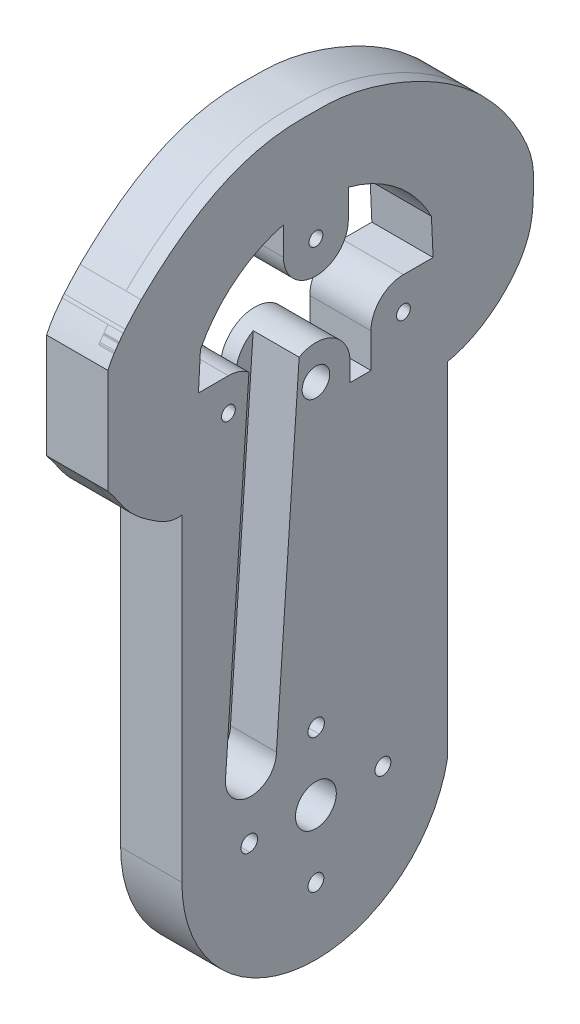
from build123d import *

# Parameters (mm, degrees)
ESQUISSE1_R        = 1.5499999999999952
ESQUISSE1_R_2      = 1.5499999999999983
ESQUISSE1_R_3      = 4.000000000000001
ESQUISSE1_R_4      = 1.5499999999999987
ESQUISSE1_R_5      = 1.3525499999999895
ESQUISSE1_R_6      = 2.705099999999987
ESQUISSE1_R_7      = 1.3525499999999888
ESQUISSE1_R_8      = 1.3525499999999855
BOSS_EXTRU_1_DEPTH = 3
ESQUISSE3_R        = 1.3525499999999735
ESQUISSE3_R_2      = 2.705099999999999
ESQUISSE3_R_3      = 1.352549999999999
ESQUISSE3_R_4      = 1.3525499999999995
ESQUISSE3_R_5      = 1.5499999999999932
ESQUISSE3_R_6      = 1.549999999999969
ESQUISSE3_R_7      = 4.00000000000002
BOSS_EXTRU_2_DEPTH = 6
ESQUISSE4_R        = 1.5499999999999932
ESQUISSE4_R_2      = 4.00000000000002
ESQUISSE4_R_3      = 1.5500000000000196
ESQUISSE4_R_4      = 1.3525499999999724
ESQUISSE4_R_5      = 2.705099999999999
ESQUISSE4_R_6      = 1.352549999999999
BOSS_EXTRU_3_DEPTH = 3


with BuildPart() as part:
    # Esquisse1 → Boss.-Extru.1 (new body)
    with BuildSketch(Plane(origin=(0, 0, 0), x_dir=(0, 0, -1), z_dir=(1, 0, 0))):
        with BuildLine():
            Line((-40.60824999999997, -12.7), (-40.60824999999999, -16.144875000000003))
            Line((-40.60824999999999, -16.144875000000003), (-40.608250000000126, -16.348305131634127))
            add(Edge.make_bspline(
                [(-40.608250000000126, -16.34830513163413), (-40.365634485085174, -16.66119360496381), (-40.112338127058464, -16.96547541984117), (-39.6302050699173, -17.593748723066007), (-39.40068803219234, -17.91719199232713), (-38.71904593852416, -18.893089110716275), (-38.271947043549716, -19.549593056857432), (-37.33854099825812, -20.83100680823567), (-36.855460104120894, -21.45851634129644), (-36.059725811103526, -22.342477590803163), (-35.781944123669106, -22.627029046840978), (-35.20286821244409, -23.177185479911834), (-34.90067438266666, -23.443503751290823), (-33.97194316580395, -24.212706180874235), (-33.32440588222247, -24.68538384924446), (-32.01080528172552, -25.604549776135908), (-31.3480895281368, -26.055770332520353), (-30.303090708448146, -26.660610545558157), (-29.948270215296816, -26.84869689164848), (-29.22248372075406, -27.18497100489982), (-28.851412003903157, -27.33377353761804), (-28.083597976471083, -27.570691367701894), (-27.685315555358933, -27.65797605698594), (-27.090666934399625, -27.715403345514545), (-26.891908645154633, -27.72263102460254), (-26.592836887932044, -27.71293649097741), (-26.492990430934693, -27.70627899212659), (-26.29296393574283, -27.68563201362946), (-26.19273293174235, -27.670522326028014), (-26.092449031487906, -27.65425000000004)],
                knots=[0, 0, 0, 0, 0.06250000000000011, 0.06250000000000011, 0.12500000000000022, 0.12500000000000022, 0.25, 0.25, 0.3749999999999998, 0.3749999999999998, 0.4374999999999999, 0.4374999999999999, 0.5, 0.5, 0.6249999999999997, 0.6249999999999997, 0.7499999999999993, 0.7499999999999993, 0.8124999999999996, 0.8124999999999996, 0.8749999999999998, 0.8749999999999998, 0.9375, 0.9375, 0.96875, 0.96875, 0.9843750000000001, 0.9843750000000001, 1, 1, 1, 1], degree=3))
            Line((-26.09244903148791, -27.654250000000037), (-26.09244903148791, -90))
            ThreePointArc((-26.092449031487916, -90), (2.645516689864672, -116.14013033987462), (25.954024412489332, -85.0613505097137))
            Line((25.954024412489336, -85.0613505097137), (25.954024412489336, -27.654249999999962))
            add(Edge.make_bspline(
                [(25.954024412489336, -27.654249999999955), (27.179118801718648, -27.419536533166706), (28.35337780768259, -27.051803075117984), (30.057053830202985, -26.349187710343546), (30.61512648477753, -26.0892884726289), (31.712904721010446, -25.521429222970447), (32.254485023866394, -25.21211881538357), (33.82720410612195, -24.230350535962074), (34.81402546285917, -23.502087852235476), (36.67200735830084, -21.907218092873883), (37.54332030538343, -21.040793316177776), (38.75190277114726, -19.623473398466476), (39.13471450874684, -19.13496298945798), (39.85101433311271, -18.131439591198927), (40.185535135183365, -17.615291382357196), (40.80136236177384, -16.5505955575091), (41.08263549692741, -16.002027673376396), (41.45701591121505, -15.150237788716874), (41.574249194133394, -14.860422639608764), (41.78971390606594, -14.277065553938337), (41.88804924830858, -13.983513219853538), (42.33468853404608, -12.506770958760937), (42.54623976115454, -11.296312151355938), (42.71756835639342, -9.451511475078737), (42.75061164947975, -8.83067760967362), (42.77285986561765, -7.900507945962923), (42.775360473707075, -7.590422151145716), (42.775559929710695, -6.97022199764531), (42.77208725179593, -6.660100669995436), (42.77208725179598, -6.35000000000085)],
                knots=[0, 0, 0, 0, 0.12499999999999994, 0.12499999999999994, 0.18750000000000008, 0.18750000000000008, 0.2500000000000002, 0.2500000000000002, 0.3750000000000005, 0.3750000000000005, 0.5000000000000008, 0.5000000000000008, 0.5625000000000008, 0.5625000000000008, 0.6250000000000007, 0.6250000000000007, 0.6875000000000007, 0.6875000000000007, 0.7187500000000006, 0.7187500000000006, 0.7500000000000004, 0.7500000000000004, 0.875, 0.875, 0.9374999999999999, 0.9374999999999999, 0.9687499999999999, 0.9687499999999999, 1, 1, 1, 1], degree=3))
            add(Edge.make_bspline(
                [(42.77208725179598, -6.35000000000085), (42.77208725179518, -5.874878454420338), (42.783792206527956, -5.398095979474916), (42.789657916868265, -4.447020545876502), (42.781867466952676, -3.9730044626685204), (42.67254639574517, -2.563152451263197), (42.49917921337603, -1.6375101083020898), (42.10628201696776, -0.2678974591353784), (41.95406853551253, 0.18562504169659108), (41.61481943500583, 1.0877287930782762), (41.430081296584, 1.5302830339265894), (40.84491149528861, 2.8392590835466924), (40.41660456120057, 3.689518780701334), (39.04678328265365, 6.190525131350697), (38.01312330399673, 7.7872515841477075), (36.29165744568243, 10.08210697671183), (35.68850954706187, 10.830664164257108), (34.43654182017242, 12.281738952771459), (33.78619988302627, 12.985690235020341), (33.11207499999998, 13.668565083231329)],
                knots=[0, 0, 0, 0, 0.06250000000000003, 0.06250000000000003, 0.12500000000000006, 0.12500000000000006, 0.24999999999999997, 0.24999999999999997, 0.3124999999999999, 0.3124999999999999, 0.3749999999999999, 0.3749999999999999, 0.5000000000000002, 0.5000000000000002, 0.7500000000000003, 0.7500000000000003, 0.8750000000000001, 0.8750000000000001, 1, 1, 1, 1], degree=3))
            add(Edge.make_bspline(
                [(33.112075, 13.668565083231325), (32.33220795486775, 14.539101946139125), (31.435060987062897, 15.277734234492385)],
                knots=[0, 0, 0, 1, 1, 1], degree=2))
            add(Edge.make_bspline(
                [(31.435060987062897, 15.277734234492385), (30.299691041308236, 16.309376592490306), (29.113704515664836, 17.275445234871217), (26.6466048305771, 19.084346085125258), (25.360475951228903, 19.928267183493574), (21.43229776932603, 22.265681685749215), (18.701678279528252, 23.563722979210173), (14.477833081648752, 25.213127628280468), (13.049229105244862, 25.71486415952927), (10.864398428424204, 26.369911185203367), (10.12906170309748, 26.57183213638624), (8.641563989669635, 26.936524394267035), (7.89083157192484, 27.098844789097125), (5.637990781516612, 27.51241220781118), (4.127431428249407, 27.69372769630636), (2.225306731202307, 27.768676851477696), (1.844136037536198, 27.775542931063026), (1.0809407860587825, 27.779973661479737), (0.6989047691417656, 27.77741348442609), (-0.44634668852812603, 27.779064109234426), (-1.208874123410741, 27.797823926116227), (-2.7326822388819156, 27.815308111039577), (-3.4920854713532217, 27.806304752702626), (-5.004084105432311, 27.739990771478098), (-5.756994671196242, 27.684916502368054), (-8.006157922423963, 27.451797552402233), (-9.492662783689791, 27.204583890743887), (-11.701987235660551, 26.68877527741111), (-12.434852330937622, 26.49146159823533), (-13.894254142024575, 26.051929084747414), (-14.622118918624757, 25.80749349719222), (-16.765417144448694, 25.012233880270134), (-18.15150036933967, 24.400517873976742), (-20.847821734692953, 23.032525232038434), (-22.158708475332947, 22.277484827463585), (-24.716496251974732, 20.645447350961245), (-25.966430559050142, 19.765232599712107), (-28.39125747007988, 17.919703458017853), (-29.567431908494203, 16.954258356946394), (-31.28755717277032, 15.454109034176787), (-31.853805839893464, 14.945666112150485), (-32.972832422867484, 13.912915080440603), (-33.52577930998253, 13.388805976793128), (-34.06609644329648, 12.849822170905842)],
                knots=[0, 0, 0, 0, 0.06250000000000003, 0.06250000000000003, 0.12500000000000006, 0.12500000000000006, 0.25000000000000033, 0.25000000000000033, 0.3125000000000005, 0.3125000000000005, 0.34375000000000056, 0.34375000000000056, 0.3750000000000006, 0.3750000000000006, 0.4375000000000006, 0.4375000000000006, 0.4531250000000006, 0.4531250000000006, 0.4687500000000006, 0.4687500000000006, 0.5000000000000006, 0.5000000000000006, 0.5312500000000006, 0.5312500000000006, 0.5625000000000006, 0.5625000000000006, 0.6250000000000006, 0.6250000000000006, 0.6562500000000006, 0.6562500000000006, 0.6875000000000006, 0.6875000000000006, 0.7500000000000004, 0.7500000000000004, 0.8125000000000003, 0.8125000000000003, 0.8750000000000002, 0.8750000000000002, 0.9375000000000002, 0.9375000000000002, 0.9687500000000001, 0.9687500000000001, 1, 1, 1, 1], degree=3))
            add(Edge.make_bspline(
                [(-34.06609644329648, 12.849822170905837), (-35.159801617542875, 11.692162737351145), (-36.25108162130856, 10.537402840079448), (-37.16658053159576, 9.40494717090583)],
                knots=[0, 0, 0, 0, 1, 1, 1, 1], degree=3))
            ThreePointArc((-37.16658053159577, 9.404947170905835), (-37.36301468524006, 9.16028104187254), (-37.55779661569344, 8.914297524166702))
            add(Edge.make_bspline(
                [(-37.55779661569345, 8.914297524166699), (-38.142933538997205, 8.170182683428195), (-38.70952284495091, 7.412667282430255), (-39.741912271517116, 5.824816800894257), (-40.203133529042645, 4.998794666098791), (-40.60824999999987, 4.142494902026808)],
                knots=[0, 0, 0, 0, 0.5, 0.5, 1, 1, 1, 1], degree=3))
            Line((-40.60824999999987, 4.142494902026814), (-40.60824999999997, -12.7))
        make_face()
        with Locations((0.16510000000002353, -103.12877451574396)):
            Circle(ESQUISSE1_R, mode=Mode.SUBTRACT)
        with Locations((-12.963674515743943, -90.0000000000001)):
            Circle(ESQUISSE1_R_2, mode=Mode.SUBTRACT)
        with Locations((0.16510000000001498, -90)):
            Circle(ESQUISSE1_R_3, mode=Mode.SUBTRACT)
        with Locations((0.1650999999999718, -76.87122548425604)):
            Circle(ESQUISSE1_R_4, mode=Mode.SUBTRACT)
        with Locations((13.293874515743973, -90)):
            Circle(ESQUISSE1_R_2, mode=Mode.SUBTRACT)
        with Locations((-16.979899999999997, -14.922499999999971)):
            Circle(ESQUISSE1_R_5, mode=Mode.SUBTRACT)
        with Locations((0.16510000000000483, -18.224499999999964)):
            Circle(ESQUISSE1_R_6, mode=Mode.SUBTRACT)
        with BuildLine():
            Line((-6.184899999999998, 11.646916554029167), (-6.184899999999998, 6.103472305612069))
            ThreePointArc((-6.184899999999998, 6.103472305612069), (0.165100000000006, -0.24652769438792888), (6.51510000000001, 6.103472305612069))
            Line((6.51510000000001, 6.103472305612069), (6.51510000000001, 11.646916554029167))
            ThreePointArc((6.5151000000000145, 11.646916554029168), (16.056799278049922, 6.8679592799454525), (22.793325, -1.4086148263959402))
            Line((22.793324999999996, -1.408614826395942), (23.125904239958533, -8.57249999999997))
            Line((23.125904239958533, -8.57249999999997), (17.310100000000006, -8.572499999999971))
            ThreePointArc((17.310100000000006, -8.572499999999973), (12.819971939465429, -10.432371939465394), (10.960100000000008, -14.922499999999971))
            Line((10.960100000000006, -14.922499999999971), (10.960100000000006, -21.66937500000002))
            Line((10.960100000000006, -21.66937500000002), (6.880225000000006, -21.669375000000013))
            Line((6.880225000000006, -21.669375000000013), (6.880225000000006, -18.224499999999964))
            ThreePointArc((6.880225000000005, -18.224499999999964), (0.16510000000000466, -11.509374999999963), (-6.550024999999996, -18.224499999999964))
            Line((-6.550024999999996, -18.224499999999964), (-6.550024999999996, -21.669374999999995))
            Line((-6.550024999999996, -21.669374999999995), (-10.629899999999996, -21.669374999999988))
            Line((-10.629899999999996, -21.669374999999988), (-10.629899999999996, -14.922499999999971))
            ThreePointArc((-10.629899999999996, -14.922499999999971), (-12.48977193946542, -10.432371939465394), (-16.979899999999997, -8.57249999999997))
            Line((-16.979899999999997, -8.572499999999971), (-22.848998606298945, -8.57249999999997))
            Line((-22.848998606298945, -8.57249999999997), (-22.463124999999994, -1.408614826395956))
            ThreePointArc((-22.463124999999994, -1.4086148263959526), (-15.726599278049921, 6.867959279945454), (-6.184899999999998, 11.646916554029167))
        make_face(mode=Mode.SUBTRACT)
        with Locations((0.16510000000000144, 6.103472305612071)):
            Circle(ESQUISSE1_R_7, mode=Mode.SUBTRACT)
        with Locations((17.310100000000006, -14.922499999999971)):
            Circle(ESQUISSE1_R_8, mode=Mode.SUBTRACT)
    extrude(amount=BOSS_EXTRU_1_DEPTH)

    # Esquisse3 → Boss.-Extru.2 (add)
    with BuildSketch(Plane(origin=(3, 0, 0), x_dir=(0, 0, -1), z_dir=(1, 0, 0))):
        with BuildLine():
            Line((-40.608249999999984, -16.144875000000003), (-40.608250000000126, -16.348305131634127))
            add(Edge.make_bspline(
                [(-40.608250000000126, -16.348305131634127), (-40.36563448508518, -16.66119360496381), (-40.11233812705847, -16.96547541984117), (-39.630205069917295, -17.593748723066007), (-39.40068803219235, -17.91719199232713), (-38.719045938524154, -18.893089110716275), (-38.27194704354972, -19.549593056857436), (-37.33854099825812, -20.831006808235674), (-36.85546010412089, -21.45851634129644), (-36.05972581110353, -22.342477590803167), (-35.78194412366911, -22.627029046840978), (-35.20286821244409, -23.177185479911838), (-34.90067438266666, -23.443503751290823), (-33.97194316580396, -24.212706180874235), (-33.324405882222464, -24.68538384924446), (-32.01080528172551, -25.6045497761359), (-31.348089528136807, -26.055770332520353), (-30.30309070844814, -26.66061054555816), (-29.94827021529681, -26.848696891648473), (-29.22248372075406, -27.18497100489983), (-28.85141200390315, -27.33377353761805), (-28.083597976471086, -27.5706913677019), (-27.68531555535894, -27.65797605698594), (-27.090666934399625, -27.715403345514545), (-26.891908645154643, -27.72263102460255), (-26.59283688793204, -27.712936490977416), (-26.4929904309347, -27.7062789921266), (-26.292963935742847, -27.68563201362946), (-26.192732931742345, -27.670522326028024), (-26.092449031487913, -27.654250000000044)],
                knots=[0, 0, 0, 0, 0.06250000000000011, 0.06250000000000011, 0.12500000000000022, 0.12500000000000022, 0.25, 0.25, 0.3749999999999998, 0.3749999999999998, 0.4374999999999999, 0.4374999999999999, 0.5, 0.5, 0.6249999999999997, 0.6249999999999997, 0.7499999999999993, 0.7499999999999993, 0.8124999999999996, 0.8124999999999996, 0.8749999999999998, 0.8749999999999998, 0.9375, 0.9375, 0.96875, 0.96875, 0.9843750000000001, 0.9843750000000001, 1, 1, 1, 1], degree=3))
            Line((-26.092449031487913, -27.654250000000044), (-26.092449031487913, -89.99999999999983))
            ThreePointArc((-26.092449031487913, -89.99999999999983), (-2.3153166898646287, -116.14013033987443), (25.95402441248934, -94.93864949028602))
            Line((25.95402441248934, -94.93864949028602), (25.95402441248934, -27.654249999999973))
            add(Edge.make_bspline(
                [(25.95402441248934, -27.654249999999973), (27.179118801718637, -27.41953653316671), (28.3533778076826, -27.05180307511799), (30.05705383020299, -26.349187710343546), (30.615126484777544, -26.0892884726289), (31.71290472101046, -25.52142922297045), (32.25448502386641, -25.212118815383562), (33.82720410612195, -24.230350535962074), (34.81402546285916, -23.502087852235476), (36.67200735830084, -21.907218092873883), (37.54332030538343, -21.040793316177776), (38.751902771147265, -19.62347339846648), (39.13471450874684, -19.134962989457982), (39.85101433311272, -18.131439591198927), (40.18553513518336, -17.615291382357196), (40.80136236177384, -16.5505955575091), (41.08263549692742, -16.002027673376396), (41.45701591121506, -15.150237788716874), (41.57424919413339, -14.860422639608764), (41.78971390606595, -14.277065553938337), (41.888049248308576, -13.983513219853538), (42.334688534046094, -12.506770958760939), (42.54623976115454, -11.296312151355938), (42.71756835639343, -9.451511475078735), (42.750611649479744, -8.83067760967362), (42.772859865617654, -7.900507945962923), (42.77536047370706, -7.590422151145717), (42.77555992971069, -6.970221997645309), (42.77208725179593, -6.660100669995436), (42.77208725179599, -6.35000000000085)],
                knots=[0, 0, 0, 0, 0.12499999999999994, 0.12499999999999994, 0.18750000000000008, 0.18750000000000008, 0.2500000000000002, 0.2500000000000002, 0.3750000000000005, 0.3750000000000005, 0.5000000000000008, 0.5000000000000008, 0.5625000000000008, 0.5625000000000008, 0.6250000000000007, 0.6250000000000007, 0.6875000000000007, 0.6875000000000007, 0.7187500000000006, 0.7187500000000006, 0.7500000000000004, 0.7500000000000004, 0.875, 0.875, 0.9374999999999999, 0.9374999999999999, 0.9687499999999999, 0.9687499999999999, 1, 1, 1, 1], degree=3))
            add(Edge.make_bspline(
                [(42.77208725179599, -6.35000000000085), (42.772087251795185, -5.8748784544203385), (42.78379220652795, -5.398095979474917), (42.78965791686826, -4.447020545876503), (42.781867466952676, -3.9730044626685204), (42.672546395745165, -2.5631524512631976), (42.49917921337604, -1.6375101083020895), (42.106282016967754, -0.2678974591353786), (41.95406853551253, 0.18562504169659066), (41.614819435005835, 1.0877287930782762), (41.430081296583985, 1.5302830339265894), (40.84491149528863, 2.8392590835466924), (40.41660456120058, 3.6895187807013343), (39.04678328265365, 6.190525131350697), (38.01312330399673, 7.7872515841477075), (36.29165744568244, 10.082106976711827), (35.68850954706188, 10.830664164257106), (34.436541820172415, 12.28173895277146), (33.78619988302628, 12.98569023502034), (33.11207499999999, 13.668565083231329)],
                knots=[0, 0, 0, 0, 0.06250000000000003, 0.06250000000000003, 0.12500000000000006, 0.12500000000000006, 0.24999999999999997, 0.24999999999999997, 0.3124999999999999, 0.3124999999999999, 0.3749999999999999, 0.3749999999999999, 0.5000000000000002, 0.5000000000000002, 0.7500000000000003, 0.7500000000000003, 0.8750000000000001, 0.8750000000000001, 1, 1, 1, 1], degree=3))
            add(Edge.make_bspline(
                [(33.11207499999999, 13.668565083231329), (32.33220795486774, 14.539101946139121), (31.43506098706289, 15.277734234492382)],
                knots=[0, 0, 0, 1, 1, 1], degree=2))
            add(Edge.make_bspline(
                [(31.43506098706289, 15.277734234492382), (30.299691041308225, 16.309376592490302), (29.113704515664836, 17.275445234871217), (26.646604830577097, 19.084346085125258), (25.360475951228896, 19.92826718349357), (21.432297769326038, 22.265681685749215), (18.70167827952826, 23.56372297921017), (14.47783308164874, 25.213127628280468), (13.049229105244864, 25.714864159529267), (10.86439842842421, 26.369911185203367), (10.129061703097491, 26.57183213638624), (8.641563989669642, 26.936524394267035), (7.890831571924828, 27.09884478909713), (5.637990781516611, 27.51241220781118), (4.127431428249395, 27.693727696306357), (2.2253067312023034, 27.768676851477696), (1.8441360375361926, 27.77554293106303), (1.080940786058776, 27.77997366147974), (0.6989047691417782, 27.777413484426095), (-0.4463466885281375, 27.77906410923443), (-1.2088741234107525, 27.797823926116234), (-2.732682238881928, 27.815308111039574), (-3.4920854713532123, 27.806304752702623), (-5.004084105432321, 27.739990771478105), (-5.756994671196253, 27.68491650236805), (-8.006157922423956, 27.451797552402233), (-9.492662783689793, 27.204583890743884), (-11.701987235660544, 26.68877527741111), (-12.434852330937607, 26.491461598235333), (-13.89425414202458, 26.051929084747414), (-14.62211891862475, 25.807493497192215), (-16.76541714444868, 25.012233880270134), (-18.151500369339658, 24.40051787397674), (-20.84782173469296, 23.03252523203843), (-22.15870847533294, 22.27748482746358), (-24.716496251974725, 20.64544735096124), (-25.966430559050153, 19.765232599712103), (-28.391257470079896, 17.919703458017853), (-29.5674319084942, 16.954258356946394), (-31.28755717277032, 15.454109034176783), (-31.85380583989347, 14.945666112150484), (-32.972832422867484, 13.9129150804406), (-33.52577930998253, 13.388805976793126), (-34.06609644329647, 12.849822170905837)],
                knots=[0, 0, 0, 0, 0.06250000000000003, 0.06250000000000003, 0.12500000000000006, 0.12500000000000006, 0.25000000000000033, 0.25000000000000033, 0.3125000000000005, 0.3125000000000005, 0.34375000000000056, 0.34375000000000056, 0.3750000000000006, 0.3750000000000006, 0.4375000000000006, 0.4375000000000006, 0.4531250000000006, 0.4531250000000006, 0.4687500000000006, 0.4687500000000006, 0.5000000000000006, 0.5000000000000006, 0.5312500000000006, 0.5312500000000006, 0.5625000000000006, 0.5625000000000006, 0.6250000000000006, 0.6250000000000006, 0.6562500000000006, 0.6562500000000006, 0.6875000000000006, 0.6875000000000006, 0.7500000000000004, 0.7500000000000004, 0.8125000000000003, 0.8125000000000003, 0.8750000000000002, 0.8750000000000002, 0.9375000000000002, 0.9375000000000002, 0.9687500000000001, 0.9687500000000001, 1, 1, 1, 1], degree=3))
            add(Edge.make_bspline(
                [(-34.06609644329647, 12.849822170905837), (-35.15980161754287, 11.692162737351138), (-36.25108162130857, 10.53740284007944), (-37.16658053159577, 9.404947170905832)],
                knots=[0, 0, 0, 0, 1, 1, 1, 1], degree=3))
            ThreePointArc((-37.16658053159577, 9.404947170905832), (-37.36301468524006, 9.160281041872544), (-37.557796615693434, 8.914297524166692))
            add(Edge.make_bspline(
                [(-37.557796615693434, 8.914297524166692), (-38.14293353899721, 8.170182683428193), (-38.709522844950925, 7.412667282430254), (-39.741912271517116, 5.824816800894257), (-40.20313352904266, 4.998794666098793), (-40.60824999999987, 4.142494902026814)],
                knots=[0, 0, 0, 0, 0.5, 0.5, 1, 1, 1, 1], degree=3))
            Line((-40.60824999999987, 4.142494902026814), (-40.60824999999997, -12.7))
            Line((-40.60824999999997, -12.7), (-40.608249999999984, -16.144875000000003))
        make_face()
        with Locations((-16.979899999999994, -14.922499999999971)):
            Circle(ESQUISSE3_R, mode=Mode.SUBTRACT)
        with Locations((0.16510000000000136, -18.224499999999964)):
            Circle(ESQUISSE3_R_2, mode=Mode.SUBTRACT)
        with Locations((17.310099999999995, -14.922499999999971)):
            Circle(ESQUISSE3_R_3, mode=Mode.SUBTRACT)
        with Locations((0.16510000000000136, 6.103472305612071)):
            Circle(ESQUISSE3_R_4, mode=Mode.SUBTRACT)
        with Locations((0.1651000000000291, -103.12877451574379)):
            Circle(ESQUISSE3_R_5, mode=Mode.SUBTRACT)
        with Locations(Location((-12.818304565236966, -89.99046578621355, 0), (0, 0, 96.445985004))):
            Circle(ESQUISSE3_R_5, mode=Mode.SUBTRACT)
        with Locations(Location((0.27487463552389635, -76.82619220248466, 0), (0, 0, 114.498639067))):
            Circle(ESQUISSE3_R_6, mode=Mode.SUBTRACT)
        with Locations((13.293874515743987, -89.99999999999983)):
            Circle(ESQUISSE3_R_5, mode=Mode.SUBTRACT)
        with Locations((0.16510000000000136, -89.99999999999983)):
            Circle(ESQUISSE3_R_7, mode=Mode.SUBTRACT)
        with BuildLine():
            Line((-6.184899999999994, 6.103472305612069), (-6.184899999999994, 11.646916554029172))
            ThreePointArc((-6.184899999999994, 11.646916554029172), (-15.726599278049925, 6.86795927994546), (-22.463125, -1.408614826395956))
            Line((-22.463125, -1.408614826395956), (-22.848998606298938, -8.57249999999997))
            Line((-22.848998606298938, -8.57249999999997), (-16.979899999999994, -8.57249999999997))
            ThreePointArc((-16.979899999999994, -8.57249999999997), (-14.843492836703497, -8.942678561811752), (-12.956172958809672, -10.010054509412438))
            Line((-12.956172958809672, -10.010054509412438), (-17.524395623099757, -76.45837810021335))
            ThreePointArc((-17.524395623099757, -76.45837810021335), (-12.914369904026863, -82.13085492882756), (-7.5714368538587555, -77.14262909962736))
            Line((-7.5714368538587555, -77.14262909962736), (-3.1181943124567826, -12.366780117365243))
            ThreePointArc((-3.1181943124567826, -12.366780117365243), (3.5595934854620666, -12.430510205153858), (6.880225000000017, -18.224499999999964))
            Line((6.880225000000017, -18.224499999999964), (6.880225000000017, -21.669375000000016))
            Line((6.880225000000017, -21.669375000000016), (10.9601, -21.669375000000024))
            Line((10.9601, -21.669375000000024), (10.9601, -14.922499999999971))
            ThreePointArc((10.9601, -14.922499999999971), (12.819971939465418, -10.432371939465394), (17.310099999999995, -8.57249999999997))
            Line((17.310099999999995, -8.57249999999997), (23.12590423995853, -8.57249999999997))
            Line((23.12590423995853, -8.57249999999997), (22.793325000000003, -1.408614826395942))
            ThreePointArc((22.793325000000003, -1.408614826395942), (16.056799278049926, 6.867959279945467), (6.515099999999996, 11.646916554029172))
            Line((6.515099999999996, 11.646916554029172), (6.515099999999996, 6.103472305612069))
            ThreePointArc((6.515099999999996, 6.103472305612069), (0.16510000000000033, -0.24652769438792443), (-6.184899999999994, 6.103472305612069))
        make_face(mode=Mode.SUBTRACT)
    extrude(amount=BOSS_EXTRU_2_DEPTH)

    # Esquisse4 → Boss.-Extru.3 (add)
    with BuildSketch(Plane(origin=(9.000000000000002, 0, 0), x_dir=(0, 0, -1), z_dir=(1, 0, 0))):
        with BuildLine():
            Line((-40.608249999999956, -12.699999999999832), (-40.608249999999984, -16.144874999999836))
            Line((-40.608249999999984, -16.144874999999836), (-40.608250000000126, -16.34830513163396))
            add(Edge.make_bspline(
                [(-40.608250000000126, -16.348305131633964), (-40.36563448508518, -16.661193604963643), (-40.11233812705847, -16.965475419841002), (-39.630205069917295, -17.59374872306584), (-39.40068803219235, -17.917191992326963), (-38.719045938524154, -18.893089110716108), (-38.27194704354972, -19.549593056857265), (-37.33854099825812, -20.831006808235504), (-36.85546010412089, -21.458516341296278), (-36.05972581110353, -22.342477590802996), (-35.78194412366911, -22.62702904684081), (-35.20286821244409, -23.177185479911667), (-34.900674382666644, -23.44350375129066), (-33.97194316580396, -24.212706180874065), (-33.324405882222464, -24.685383849244293), (-32.01080528172551, -25.604549776135745), (-31.348089528136807, -26.055770332520183), (-30.30309070844814, -26.66061054555799), (-29.94827021529681, -26.848696891648316), (-29.22248372075406, -27.18497100489965), (-28.85141200390315, -27.333773537617873), (-28.083597976471086, -27.570691367701723), (-27.68531555535894, -27.657976056985778), (-27.090666934399625, -27.715403345514382), (-26.891908645154643, -27.72263102460237), (-26.59283688793204, -27.71293649097724), (-26.4929904309347, -27.706278992126425), (-26.29296393574282, -27.685632013629295), (-26.192732931742345, -27.670522326027847), (-26.092449031487913, -27.654249999999873)],
                knots=[0, 0, 0, 0, 0.06250000000000011, 0.06250000000000011, 0.12500000000000022, 0.12500000000000022, 0.25, 0.25, 0.3749999999999998, 0.3749999999999998, 0.4374999999999999, 0.4374999999999999, 0.5, 0.5, 0.6249999999999997, 0.6249999999999997, 0.7499999999999993, 0.7499999999999993, 0.8124999999999996, 0.8124999999999996, 0.8749999999999998, 0.8749999999999998, 0.9375, 0.9375, 0.96875, 0.96875, 0.9843750000000001, 0.9843750000000001, 1, 1, 1, 1], degree=3))
            Line((-26.092449031487913, -27.654249999999866), (-26.092449031487913, -89.99999999999983))
            ThreePointArc((-26.092449031487916, -89.99999999999983), (-2.315316689864583, -116.14013033987443), (25.954024412489385, -94.93864949028604))
            Line((25.95402441248934, -94.93864949028602), (25.95402441248934, -89.99999999999983))
            Line((25.954024412489396, -89.99999999999983), (25.954024412489396, -85.06135050971355))
            Line((25.954024412489396, -85.06135050971355), (25.954024412489396, -27.6542499999998))
            add(Edge.make_bspline(
                [(25.954024412489396, -27.65424999999979), (27.179118801718776, -27.41953653316654), (28.353377807682683, -27.051803075117814), (30.057053830203103, -26.349187710343376), (30.615126484777626, -26.08928847262873), (31.712904721010542, -25.52142922297028), (32.25448502386655, -25.212118815383405), (33.82720410612208, -24.23035053596191), (34.814025462859306, -23.502087852235316), (36.672007358300924, -21.90721809287372), (37.543320305383574, -21.04079331617761), (38.7519027711474, -19.62347339846631), (39.134714508746974, -19.13496298945781), (39.85101433311281, -18.13143959119876), (40.18553513518344, -17.61529138235703), (40.801362361773926, -16.550595557508935), (41.08263549692751, -16.00202767337623), (41.457015911215116, -15.150237788716707), (41.574249194133465, -14.860422639608597), (41.789713906066034, -14.277065553938172), (41.88804924830872, -13.983513219853371), (42.334688534046236, -12.506770958760773), (42.546239761154595, -11.296312151355771), (42.717568356393535, -9.45151147507857), (42.75061164947982, -8.830677609673453), (42.77285986561777, -7.900507945962757), (42.77536047370714, -7.5904221511455505), (42.77555992971085, -6.970221997645142), (42.77208725179607, -6.66010066999527), (42.77208725179607, -6.350000000000682)],
                knots=[0, 0, 0, 0, 0.12499999999999994, 0.12499999999999994, 0.18750000000000008, 0.18750000000000008, 0.2500000000000002, 0.2500000000000002, 0.3750000000000005, 0.3750000000000005, 0.5000000000000008, 0.5000000000000008, 0.5625000000000008, 0.5625000000000008, 0.6250000000000007, 0.6250000000000007, 0.6875000000000007, 0.6875000000000007, 0.7187500000000006, 0.7187500000000006, 0.7500000000000004, 0.7500000000000004, 0.875, 0.875, 0.9374999999999999, 0.9374999999999999, 0.9687499999999999, 0.9687499999999999, 1, 1, 1, 1], degree=3))
            add(Edge.make_bspline(
                [(42.77208725179607, -6.350000000000706), (42.77208725179529, -5.874878454420196), (42.78379220652809, -5.398095979474774), (42.78965791686842, -4.447020545876361), (42.78186746695281, -3.973004462668385), (42.672546395745385, -2.563152451263061), (42.49917921337623, -1.6375101083019525), (42.106282016967896, -0.2678974591352398), (41.954068535512675, 0.18562504169673116), (41.61481943500603, 1.0877287930784185), (41.43008129658413, 1.5302830339267368), (40.84491149528882, 2.83925908354684), (40.41660456120069, 3.689518780701478), (39.04678328265379, 6.190525131350842), (38.01312330399689, 7.787251584147857), (36.29165744568255, 10.082106976711982), (35.68850954706207, 10.830664164257264), (34.43654182017256, 12.281738952771619), (33.78619988302648, 12.985690235020497), (33.11207500000016, 13.668565083231492)],
                knots=[0, 0, 0, 0, 0.06250000000000003, 0.06250000000000003, 0.12500000000000006, 0.12500000000000006, 0.24999999999999997, 0.24999999999999997, 0.3124999999999999, 0.3124999999999999, 0.3749999999999999, 0.3749999999999999, 0.5000000000000002, 0.5000000000000002, 0.7500000000000003, 0.7500000000000003, 0.8750000000000001, 0.8750000000000001, 1, 1, 1, 1], degree=3))
            add(Edge.make_bspline(
                [(33.11207500000016, 13.668565083231492), (32.332207954867826, 14.53910194613929), (31.435060987062975, 15.277734234492552)],
                knots=[0, 0, 0, 1, 1, 1], degree=2))
            add(Edge.make_bspline(
                [(31.435060987062975, 15.277734234492552), (30.299691041308392, 16.309376592490473), (29.11370451566489, 17.27544523487138), (26.646604830577264, 19.08434608512543), (25.360475951229034, 19.92826718349374), (21.43229776932609, 22.265681685749378), (18.7016782795284, 23.56372297921034), (14.477833081648711, 25.21312762828063), (13.049229105244864, 25.714864159529434), (10.86439842842421, 26.369911185203534), (10.129061703097491, 26.571832136386412), (8.641563989669642, 26.9365243942672), (7.890831571924828, 27.098844789097292), (5.637990781516611, 27.512412207811344), (4.127431428249395, 27.693727696306535), (2.2253067312023034, 27.76867685147786), (1.8441360375361926, 27.775542931063192), (1.080940786058776, 27.779973661479904), (0.6989047691417782, 27.77741348442626), (-0.4463466885281375, 27.779064109234593), (-1.2088741234107525, 27.797823926116397), (-2.732682238881928, 27.815308111039737), (-3.4920854713532123, 27.806304752702786), (-5.004084105432321, 27.73999077147827), (-5.756994671196253, 27.684916502368228), (-8.006157922423956, 27.451797552402393), (-9.492662783689793, 27.204583890744058), (-11.701987235660544, 26.688775277411278), (-12.434852330937607, 26.491461598235496), (-13.89425414202458, 26.051929084747577), (-14.62211891862475, 25.807493497192386), (-16.76541714444868, 25.0122338802703), (-18.151500369339658, 24.40051787397691), (-20.84782173469296, 23.0325252320386), (-22.15870847533294, 22.277484827463752), (-24.716496251974725, 20.645447350961412), (-25.966430559050153, 19.765232599712274), (-28.391257470079868, 17.919703458018013), (-29.5674319084942, 16.954258356946564), (-31.28755717277032, 15.454109034176954), (-31.85380583989347, 14.945666112150652), (-32.97283242286747, 13.91291508044077), (-33.52577930998252, 13.388805976793297), (-34.06609644329647, 12.849822170906009)],
                knots=[0, 0, 0, 0, 0.06250000000000003, 0.06250000000000003, 0.12500000000000006, 0.12500000000000006, 0.25000000000000033, 0.25000000000000033, 0.3125000000000005, 0.3125000000000005, 0.34375000000000056, 0.34375000000000056, 0.3750000000000006, 0.3750000000000006, 0.4375000000000006, 0.4375000000000006, 0.4531250000000006, 0.4531250000000006, 0.4687500000000006, 0.4687500000000006, 0.5000000000000006, 0.5000000000000006, 0.5312500000000006, 0.5312500000000006, 0.5625000000000006, 0.5625000000000006, 0.6250000000000006, 0.6250000000000006, 0.6562500000000006, 0.6562500000000006, 0.6875000000000006, 0.6875000000000006, 0.7500000000000004, 0.7500000000000004, 0.8125000000000003, 0.8125000000000003, 0.8750000000000002, 0.8750000000000002, 0.9375000000000002, 0.9375000000000002, 0.9687500000000001, 0.9687500000000001, 1, 1, 1, 1], degree=3))
            add(Edge.make_bspline(
                [(-34.06609644329647, 12.849822170906002), (-35.15980161754287, 11.692162737351307), (-36.25108162130857, 10.537402840079608), (-37.16658053159577, 9.404947170906)],
                knots=[0, 0, 0, 0, 1, 1, 1, 1], degree=3))
            ThreePointArc((-37.16658053159577, 9.404947170906002), (-37.36301468524006, 9.160281041872707), (-37.55779661569342, 8.914297524166852))
            add(Edge.make_bspline(
                [(-37.55779661569345, 8.914297524166878), (-38.14293353899723, 8.170182683428367), (-38.70952284495091, 7.412667282430431), (-39.7419122715171, 5.824816800894431), (-40.203133529042645, 4.998794666098968), (-40.60824999999987, 4.142494902026978)],
                knots=[0, 0, 0, 0, 0.5, 0.5, 1, 1, 1, 1], degree=3))
            Line((-40.60824999999987, 4.142494902026985), (-40.608249999999956, -12.699999999999832))
        make_face()
        with Locations((0.1651000000000291, -103.12877451574379)):
            Circle(ESQUISSE4_R, mode=Mode.SUBTRACT)
        with BuildLine():
            ThreePointArc((-12.789661465336735, -91.54020110968916), (-14.510351565382116, -90.10144015044584), (-12.99231761564418, -88.45026467652431))
            ThreePointArc((-12.99231761564418, -88.45026467652431), (-11.785643010837656, -88.83456349187134), (-11.268304565236972, -89.99046578621355))
            ThreePointArc((-11.268304565236972, -89.99046578621355), (-11.71220854660989, -91.07630720998468), (-12.789661465336735, -91.54020110968916))
        make_face(mode=Mode.SUBTRACT)
        with Locations((0.16510000000000136, -89.99999999999983)):
            Circle(ESQUISSE4_R_2, mode=Mode.SUBTRACT)
        with BuildLine():
            ThreePointArc((0.8078410240857328, -78.28168072138932), (-1.2689226709661705, -77.45951026151525), (-0.3678663885613572, -75.41573696535102))
            ThreePointArc((-0.3678663885613572, -75.41573696535102), (1.1134005482623701, -75.52259169095285), (1.8248746355238654, -76.82619220248466))
            ThreePointArc((1.8248746355238654, -76.82619220248466), (1.5454252843118006, -77.71399907836732), (0.8078410240857307, -78.28168072138932))
        make_face(mode=Mode.SUBTRACT)
        with Locations((13.293874515743987, -89.99999999999983)):
            Circle(ESQUISSE4_R_3, mode=Mode.SUBTRACT)
        with BuildLine():
            Line((-6.184899999999994, 11.646916554029337), (-6.184899999999994, 6.103472305612236))
            ThreePointArc((-6.184899999999992, 6.103472305612236), (0.16510000000000216, -0.24652769438775923), (6.515099999999997, 6.103472305612236))
            Line((6.515099999999996, 6.103472305612236), (6.515099999999996, 11.646916554029337))
            ThreePointArc((6.515099999999996, 11.646916554029335), (16.056799278049994, 6.867959279945673), (22.793325000000088, -1.4086148263957732))
            Line((22.793325000000088, -1.4086148263957736), (23.12590423995864, -8.572499999999803))
            Line((23.12590423995864, -8.572499999999803), (17.310100000000077, -8.572499999999803))
            ThreePointArc((17.310100000000077, -8.572499999999803), (12.81997193946549, -10.432371939465238), (10.9601, -14.922499999999804))
            Line((10.9601, -14.922499999999804), (10.9601, -21.669374999999853))
            Line((10.9601, -21.669374999999853), (6.880225000000017, -21.669374999999846))
            Line((6.880225000000017, -21.669374999999846), (6.880225000000017, -18.224499999999797))
            ThreePointArc((6.880225000000018, -18.224499999999797), (3.5595934854620355, -12.43051020515367), (-3.1181943124568496, -12.366780117365124))
            Line((-3.118194312456782, -12.366780117365238), (-7.5714368538587555, -77.14262909962736))
            ThreePointArc((-7.57143685385875, -77.14262909962711), (-12.914369904026739, -82.13085492882757), (-17.524395623099764, -76.45837810021335))
            Line((-17.524395623099757, -76.45837810021335), (-12.956172958809672, -10.010054509412441))
            ThreePointArc((-12.956172958809596, -10.010054509412342), (-14.843492836703449, -8.942678561811604), (-16.979899999999994, -8.572499999999803))
            Line((-16.979899999999994, -8.572499999999803), (-22.848998606298938, -8.572499999999803))
            Line((-22.848998606298938, -8.572499999999803), (-22.463125, -1.4086148263957876))
            ThreePointArc((-22.463125, -1.4086148263957838), (-15.726599278049925, 6.86795927994563), (-6.1848999999999945, 11.646916554029339))
        make_face(mode=Mode.SUBTRACT)
        with Locations((-16.979899999999994, -14.922499999999804)):
            Circle(ESQUISSE4_R_4, mode=Mode.SUBTRACT)
        with Locations((0.16510000000000136, -18.224499999999797)):
            Circle(ESQUISSE4_R_5, mode=Mode.SUBTRACT)
        with Locations((0.16510000000000136, 6.103472305612236)):
            Circle(ESQUISSE4_R_6, mode=Mode.SUBTRACT)
        with Locations((17.310100000000077, -14.922499999999804)):
            Circle(ESQUISSE4_R_6, mode=Mode.SUBTRACT)
    extrude(amount=BOSS_EXTRU_3_DEPTH)


solid = part.part
